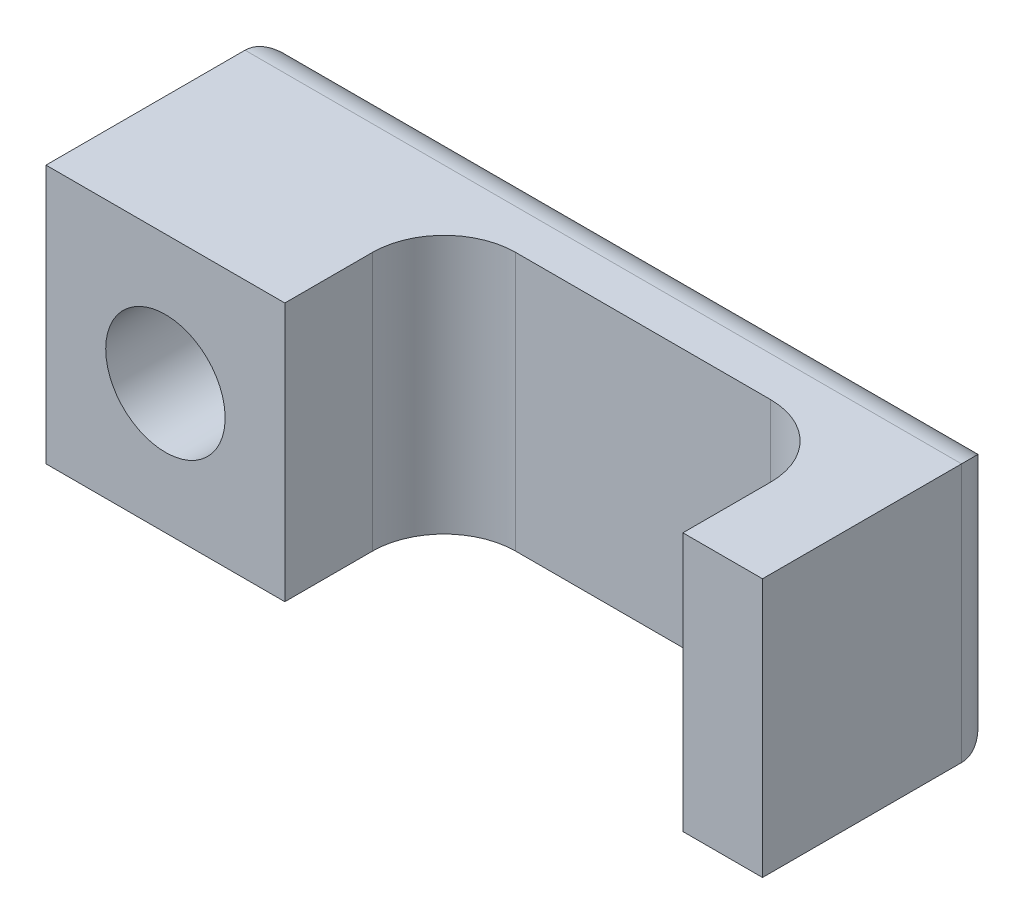
from build123d import *

# Parameters (mm, degrees)
SIDE_W         = 18
SIDE_H         = 6
SIDE_EX_DEPTH  = 6.5
HOLE_R         = 1.5
HOLE_CUT_DEPTH = 21.05617112
WIRE_CUT_DEPTH = 21.05617112
FILLET1_R      = 1


with BuildPart() as part:
    # Side → Side_Ex (new body)
    with BuildSketch(Plane(origin=(0, 0, 0), x_dir=(1, 0, 0), z_dir=(0, 1, 0))):
        with Locations((9, 3)):
            Rectangle(SIDE_W, SIDE_H)
    extrude(amount=SIDE_EX_DEPTH)

    # Hole → Hole_Cut (cut, through all)
    with BuildSketch(Plane(origin=(0, 0, -6), x_dir=(-1, 0, 0), z_dir=(0, 0, -1))):
        with Locations((-3, 3.25)):
            Circle(HOLE_R)
    extrude(amount=-HOLE_CUT_DEPTH, mode=Mode.SUBTRACT)

    # Wire 2 → Wire_Cut (cut, through all)
    with BuildSketch(Plane(origin=(0, 0, 0), x_dir=(1, 0, 0), z_dir=(0, 1, 0))):
        with BuildLine():
            Line((14.2, 4), (7.8, 4))
            ThreePointArc((7.8, 4), (6.527207794, 3.472792206), (6, 2.2))
            Line((6, 2.2), (6, 0))
            Line((6, 0), (16, 0))
            Line((16, 0), (16, 2.2))
            ThreePointArc((16, 2.2), (15.472792206, 3.472792206), (14.2, 4))
        make_face()
    extrude(amount=WIRE_CUT_DEPTH, mode=Mode.SUBTRACT)

    # Fillet1
    fillet1_edges = [part.edges().sort_by_distance(p)[0] for p in [
        (9, 6.5, -6),
        (9, 0, -6),
        (0, 3.25, -6),
        (18, 3.25, -6),
    ]]
    fillet(fillet1_edges, radius=FILLET1_R)


solid = part.part
